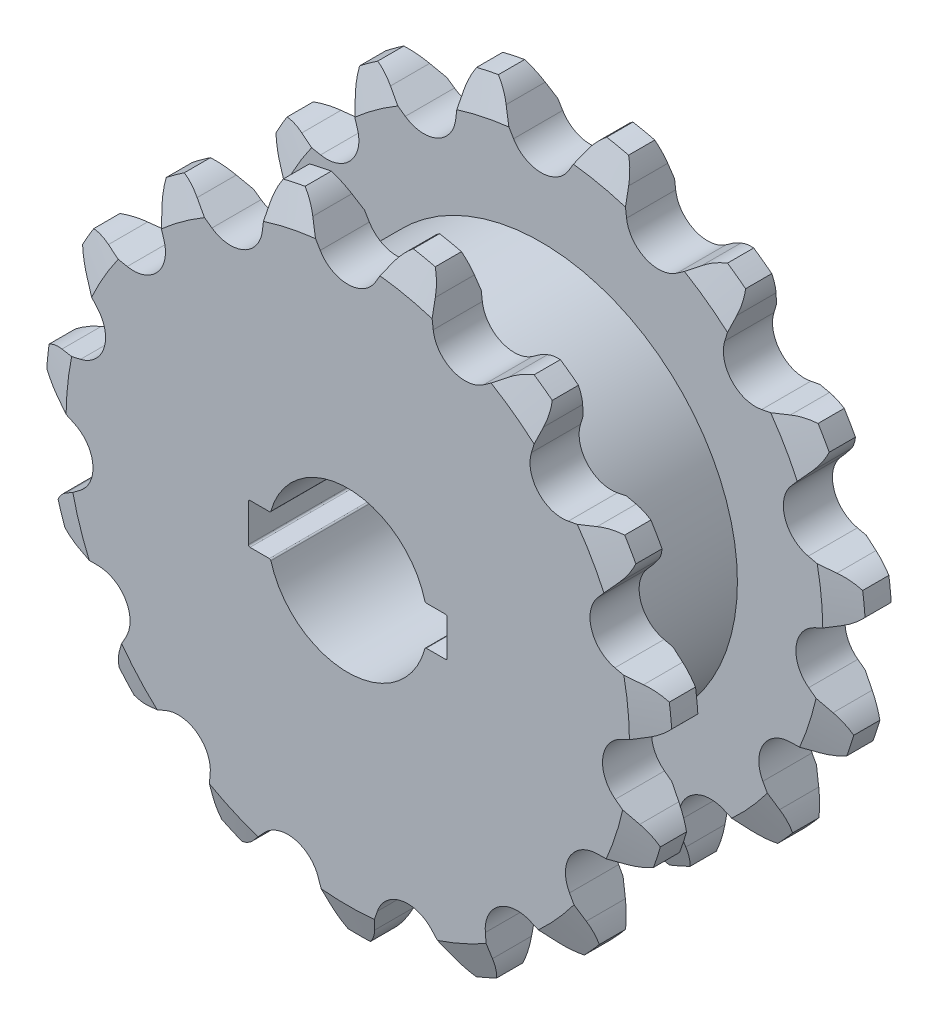
from build123d import *
from OCP.BRepFilletAPI import BRepFilletAPI_MakeChamfer

# Parameters (mm, degrees)
SKETCH1_R         = 25.2603
EXTRUDE1_DEPTH    = 3.9624
EXTRUDE2_START    = 11.6332
SKETCH2_R         = 15.83365
EXTRUDE2_DEPTH    = 11.6332
EXTRUDE3_START    = -19.558
EXTRUDE3_DEPTH    = 19.558
CHAMFER1_SIZE     = 0.9245
CHAMFER1_SIZE2    = 2.54
CHAMFER2_SIZE     = 2.54
CHAMFER2_SIZE2    = 0.9245
CIRPATTERN1_COUNT = 15
FILLET1_R         = 0.127


with BuildPart() as part:
    # Sketch1 → Extrude1 (new body)
    with BuildSketch(Plane.XY.offset(5.8166)):
        Circle(SKETCH1_R)
        with BuildLine():
            Line((6.243351517, 1.5748), (8.0137, 1.5748))
            Line((8.0137, 1.5748), (8.0137, -1.5748))
            Line((8.0137, -1.5748), (6.243351517, -1.5748))
            ThreePointArc((6.243351517, -1.5748), (0.032786981, -6.438816524), (-6.226990149, -1.6383))
            Line((-6.226990149, -1.6383), (-8.0137, -1.6383))
            Line((-8.0137, -1.6383), (-8.0137, 1.6383))
            Line((-8.0137, 1.6383), (-6.226990149, 1.6383))
            ThreePointArc((-6.226990149, 1.6383), (0.032786981, 6.438816524), (6.243351517, 1.5748))
        make_face(mode=Mode.SUBTRACT)
    extrude1 = extrude(amount=EXTRUDE1_DEPTH)

    # Sketch2 → Extrude2 (add)
    with BuildSketch(Plane(origin=(0, 0, 5.8166), x_dir=(-1, 0, 0), z_dir=(0, 0, -1)).offset(EXTRUDE2_START)):
        with Locations(Location((0, 0, 0), (0, 0, 180))):
            Circle(SKETCH2_R)
        with BuildLine():
            Line((8.0137, 1.6383), (6.226990149, 1.6383))
            ThreePointArc((6.226990149, 1.6383), (-0.032786981, 6.438816524), (-6.243351517, 1.5748))
            Line((-6.243351517, 1.5748), (-8.0137, 1.5748))
            Line((-8.0137, 1.5748), (-8.0137, -1.5748))
            Line((-8.0137, -1.5748), (-6.243351517, -1.5748))
            ThreePointArc((-6.243351517, -1.5748), (-0.032786981, -6.438816524), (6.226990149, -1.6383))
            Line((6.226990149, -1.6383), (8.0137, -1.6383))
            Line((8.0137, -1.6383), (8.0137, 1.6383))
        make_face(mode=Mode.SUBTRACT)
    extrude(amount=-EXTRUDE2_DEPTH)

    # Mirror5: Extrude1 across plane
    add(extrude1.mirror(Plane.XY))

    # Sketch3 → Extrude3 (cut)
    with BuildSketch(Plane.XY.offset(9.779).offset(EXTRUDE3_START)):
        with BuildLine():
            ThreePointArc((-2.2225, 21.935957778), (0, 20.6766), (2.2225, 21.935957778))
            Line((2.2225, 21.935957778), (2.602762911, 22.570708806))
            Line((2.602762911, 22.570708806), (3.2258, 23.610708821))
            ThreePointArc((3.2258, 23.610708821), (3.732749805, 24.302292652), (4.366362838, 24.880064945))
            ThreePointArc((4.366362838, 24.880064945), (0, 25.2603), (-4.366362838, 24.880064945))
            ThreePointArc((-4.366362838, 24.880064945), (-3.732749805, 24.302292652), (-3.2258, 23.610708821))
            Line((-3.2258, 23.610708821), (-2.602762911, 22.570708806))
            Line((-2.602762911, 22.570708806), (-2.2225, 21.935957778))
        make_face()
    extrude3 = extrude(amount=EXTRUDE3_DEPTH, mode=Mode.SUBTRACT)

    # Chamfer1: one chamfer whose edges measure the first distance from different faces: ONE call of the kernel's chamfer builder (chamfer() names one face for all edges)
    chamfer1_edges_1 = [part.edges().sort_by_distance(p)[0] for p in [
        (0, -25.2603, 9.779),
    ]]
    chamfer1_side_1 = [part.faces().sort_by_distance(p)[0] for p in [
        (0, -25.2603, 7.7978),
    ]]
    chamfer1_edges_2 = [part.edges().sort_by_distance(p)[0] for p in [
        (0, -25.2603, -5.8166),
    ]]
    chamfer1_side_2 = [part.faces().sort_by_distance(p)[0] for p in [
        (0, -25.2603, -7.7978),
    ]]
    chamfer1 = BRepFilletAPI_MakeChamfer(part.part.solid().wrapped)
    for e in chamfer1_edges_1:
        chamfer1.Add(CHAMFER1_SIZE, CHAMFER1_SIZE2, e.wrapped, chamfer1_side_1[0].wrapped)  # the first distance lies on this face
    for e in chamfer1_edges_2:
        chamfer1.Add(CHAMFER1_SIZE, CHAMFER1_SIZE2, e.wrapped, chamfer1_side_2[0].wrapped)  # the first distance lies on this face
    add(Compound.cast(chamfer1.Shape()), mode=Mode.REPLACE)

    # Chamfer2: one chamfer whose edges measure the first distance from different faces: ONE call of the kernel's chamfer builder (chamfer() names one face for all edges)
    chamfer2_edges_1 = [part.edges().sort_by_distance(p)[0] for p in [
        (0, -25.2603, 5.8166),
    ]]
    chamfer2_side_1 = [part.faces().sort_by_distance(p)[0] for p in [
        (0, -24.548514413, 5.8166),
    ]]
    chamfer2_edges_2 = [part.edges().sort_by_distance(p)[0] for p in [
        (0, -25.2603, -9.779),
    ]]
    chamfer2_side_2 = [part.faces().sort_by_distance(p)[0] for p in [
        (-4.262200971, 23.826561441, -9.779),
    ]]
    chamfer2 = BRepFilletAPI_MakeChamfer(part.part.solid().wrapped)
    for e in chamfer2_edges_1:
        chamfer2.Add(CHAMFER2_SIZE, CHAMFER2_SIZE2, e.wrapped, chamfer2_side_1[0].wrapped)  # the first distance lies on this face
    for e in chamfer2_edges_2:
        chamfer2.Add(CHAMFER2_SIZE, CHAMFER2_SIZE2, e.wrapped, chamfer2_side_2[0].wrapped)  # the first distance lies on this face
    add(Compound.cast(chamfer2.Shape()), mode=Mode.REPLACE)

    # CirPattern1: Extrude3 ×15 about axis
    cirpattern1_axis = Axis((0, 0, 0), (0, 0, 1))
    for i in range(1, CIRPATTERN1_COUNT):
        add(extrude3.rotate(cirpattern1_axis, i * 360 / CIRPATTERN1_COUNT), mode=Mode.SUBTRACT)

    # Fillet1
    fillet1_edges = [part.edges().sort_by_distance(p)[0] for p in [
        (6.243351517, 1.5748, 0),
        (-6.226990149, 1.6383, 0),
        (-8.0137, 1.6383, 0),
        (-8.0137, -1.6383, 0),
        (-6.226990149, -1.6383, 0),
        (6.243351517, -1.5748, 0),
        (8.0137, -1.5748, 0),
        (8.0137, 1.5748, 0),
    ]]
    fillet(fillet1_edges, radius=FILLET1_R)


solid = part.part
